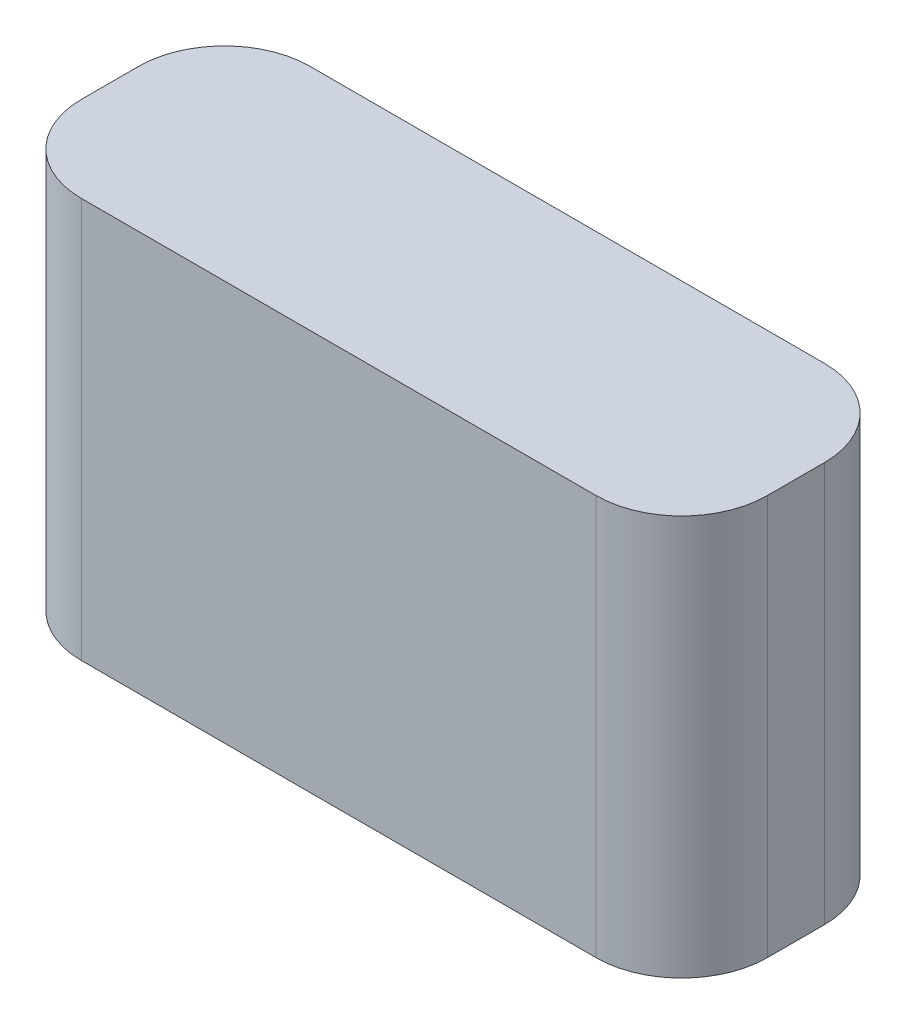
from build123d import *

# Parameters (mm, degrees)
BOSS_EXTRUDE1_DEPTH = 70


with BuildPart() as part:
    # Sketch1 → Boss-Extrude1 (new body)
    with BuildSketch(Plane(origin=(0, 0, 0), x_dir=(1, 0, 0), z_dir=(0, 1, 0))):
        with BuildLine():
            Line((-45, -20), (45, -20))
            ThreePointArc((45, -20), (55.606601718, -15.606601718), (60, -5))
            Line((60, -5), (60, 5))
            ThreePointArc((60, 5), (55.606601718, 15.606601718), (45, 20))
            Line((45, 20), (-45, 20))
            ThreePointArc((-45, 20), (-55.606601718, 15.606601718), (-60, 5))
            Line((-60, 5), (-60, -5))
            ThreePointArc((-60, -5), (-55.606601718, -15.606601718), (-45, -20))
        make_face()
    extrude(amount=BOSS_EXTRUDE1_DEPTH)


solid = part.part
